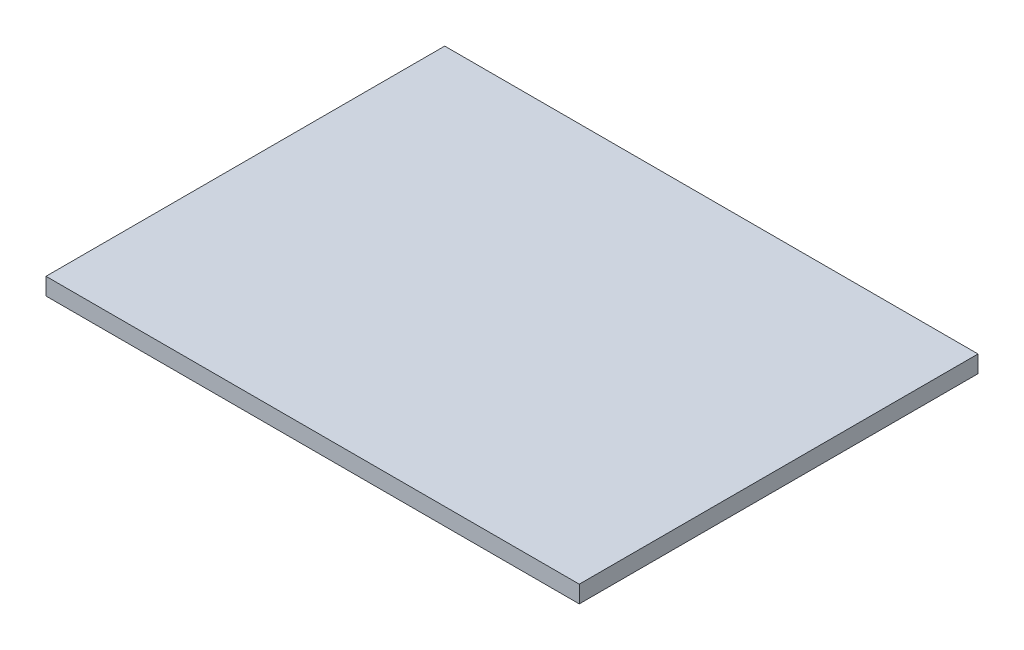
from build123d import *

# Parameters (mm, degrees)
SKETCH1_W           = 218
SKETCH1_H           = 163
BOSS_EXTRUDE1_DEPTH = 7


with BuildPart() as part:
    # Sketch1 → Boss-Extrude1 (new body)
    with BuildSketch(Plane(origin=(0, 0, 0), x_dir=(1, 0, 0), z_dir=(0, 1, 0))):
        Rectangle(SKETCH1_W, SKETCH1_H)
    extrude(amount=BOSS_EXTRUDE1_DEPTH)


solid = part.part
